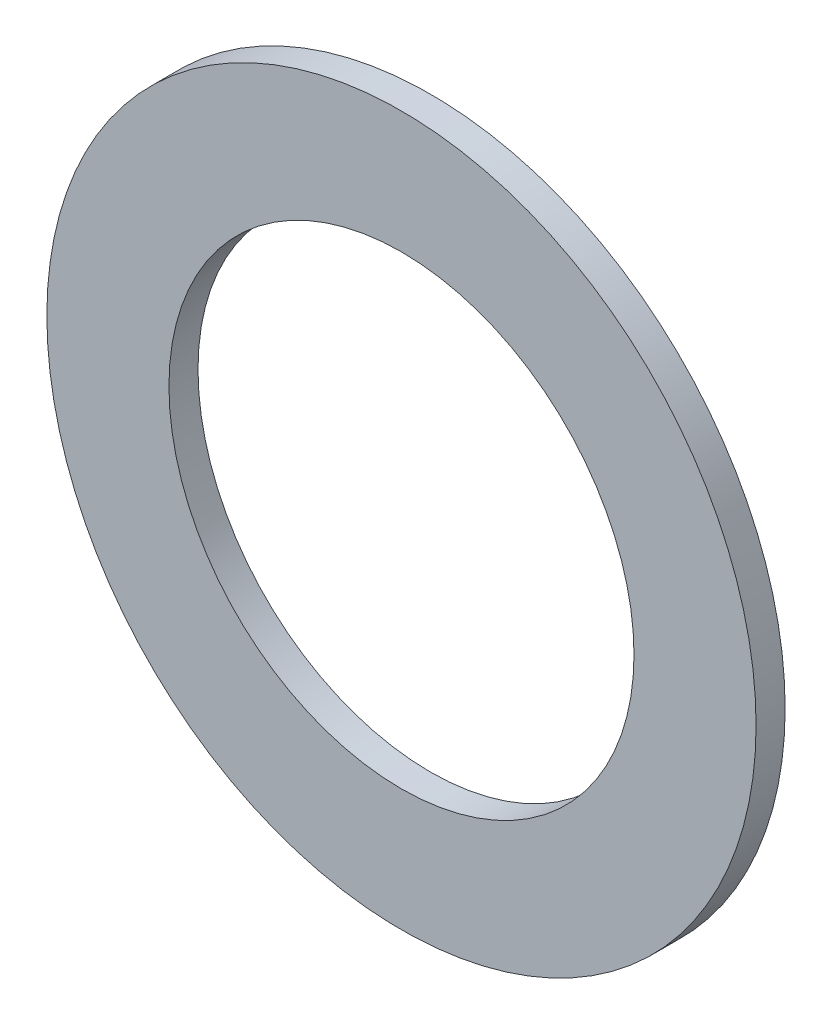
from build123d import *

# Parameters (mm, degrees)
SKETCH_1_R      = 12.2
SKETCH_1_R_2    = 8
EXTRUDE_1_DEPTH = 1


with BuildPart() as part:
    # 草图1 → 凸台-拉伸1 (new body)
    with BuildSketch(Plane.XY):
        Circle(SKETCH_1_R)
        Circle(SKETCH_1_R_2, mode=Mode.SUBTRACT)
    extrude(amount=EXTRUDE_1_DEPTH)


solid = part.part
